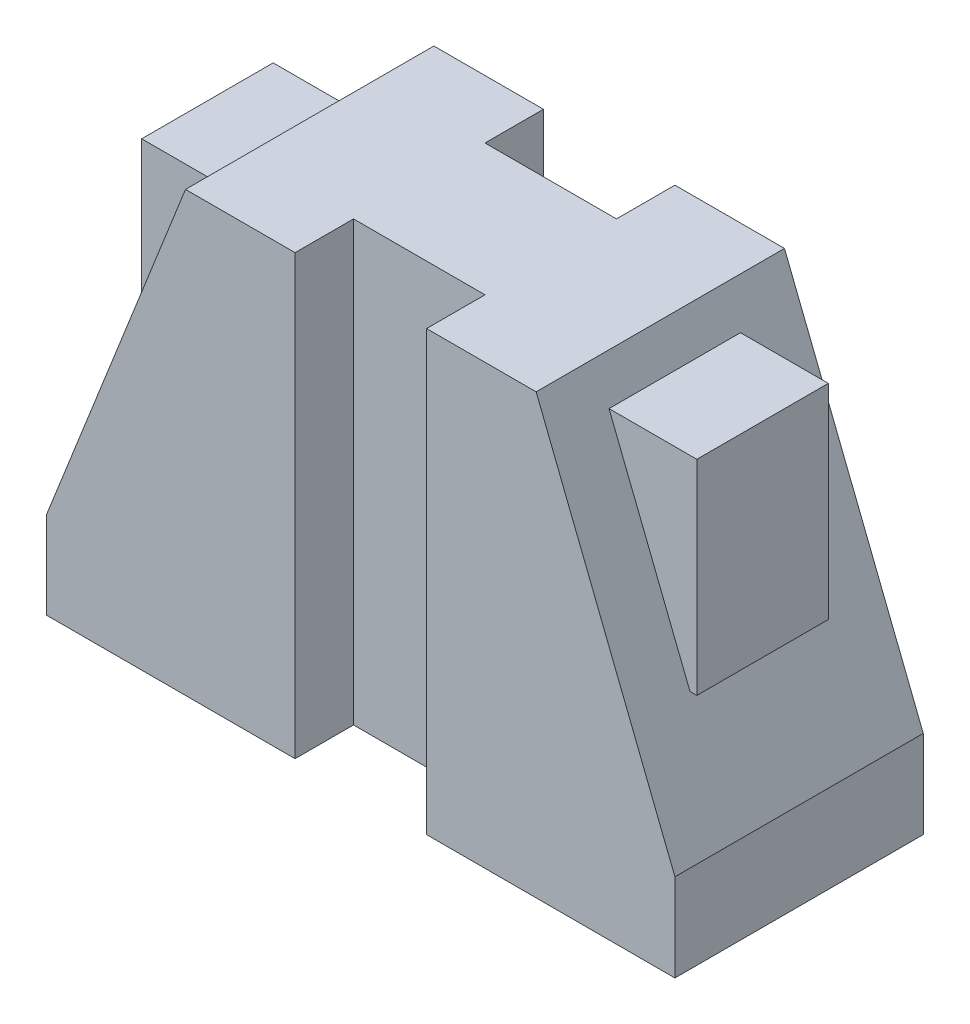
from build123d import *

# Parameters (mm, degrees)
SKETCH1_W           = 86
SKETCH1_H           = 60
BOSS_EXTRUDE1_DEPTH = 17
SKETCH2_W           = 18
SKETCH2_H           = 8
CUT_EXTRUDE1_DEPTH  = 56.118055118
CUT_EXTRUDE3_DEPTH  = 56.118055118
SKETCH4_W           = 18
SKETCH4_H           = 28
BOSS_EXTRUDE2_DEPTH = 38


with BuildPart() as part:
    # Sketch1 → Boss-Extrude1 (new, symmetric)
    with BuildSketch(Plane.XY):
        Rectangle(SKETCH1_W, SKETCH1_H)
    extrude(amount=BOSS_EXTRUDE1_DEPTH, both=True)

    # Sketch2 → Cut-Extrude1 (cut, symmetric)
    with BuildSketch(Plane(origin=(0, 0, 0), x_dir=(1, 0, 0), z_dir=(0, 1, 0))):
        with Locations((0, -13)):
            Rectangle(SKETCH2_W, SKETCH2_H)
    cut_extrude1 = extrude(amount=CUT_EXTRUDE1_DEPTH, both=True, mode=Mode.SUBTRACT)

    # Mirror1: Cut-Extrude1 across plane
    add(cut_extrude1.mirror(Plane.XY), mode=Mode.SUBTRACT)

    # Sketch3 → Cut-Extrude3 (cut, symmetric)
    with BuildSketch(Plane.XY):
        Polygon((-43, 30), (-43, -18), (-24, 30), align=None)
    cut_extrude3 = extrude(amount=CUT_EXTRUDE3_DEPTH, both=True, mode=Mode.SUBTRACT)

    # Mirror2: Cut-Extrude3 across plane
    add(cut_extrude3.mirror(Plane(origin=(0, 0, 0), x_dir=(0, 0, 1), z_dir=(1, 0, 0))), mode=Mode.SUBTRACT)

    # Sketch4 → Boss-Extrude2 (add, symmetric)
    with BuildSketch(Plane(origin=(0, 0, 0), x_dir=(0, 0, -1), z_dir=(1, 0, 0))):
        with Locations((0, 11)):
            Rectangle(SKETCH4_W, SKETCH4_H)
    extrude(amount=BOSS_EXTRUDE2_DEPTH, both=True)


solid = part.part
